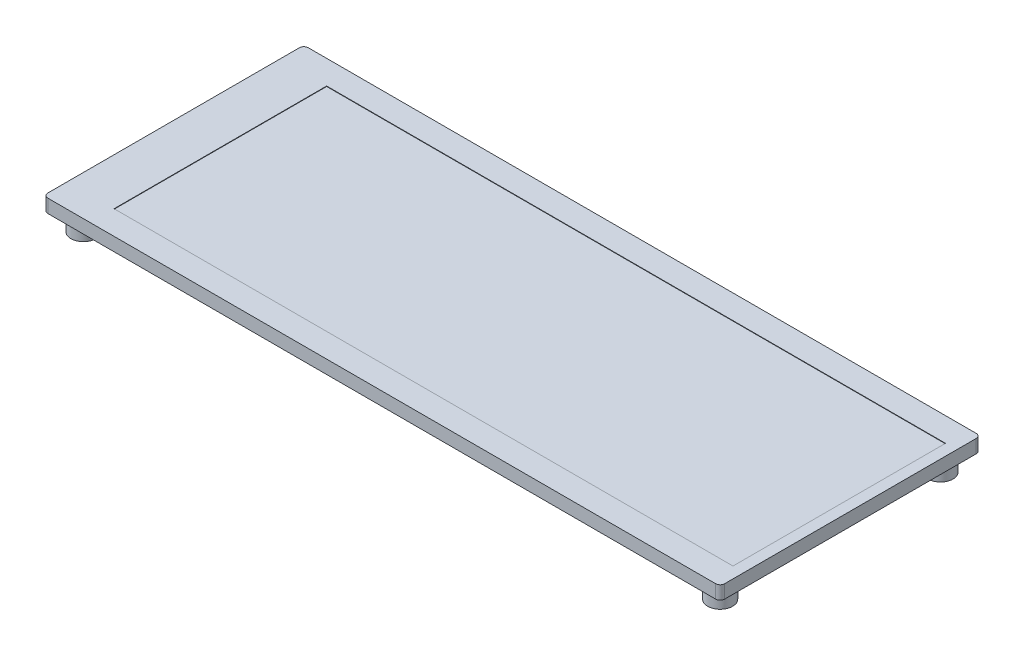
from build123d import *

# Parameters (mm, degrees)
EXTRUDE_1_DEPTH                            = 3
SKETCH_2_W                                 = 139
SKETCH_2_H                                 = 47.74
CUT_EXTRUDE_1_DEPTH                        = 0.1
SKETCH_3_R                                 = 2.8
EXTRUDE_2_DEPTH                            = 4
SKETCH_4_R                                 = 1
CUT_EXTRUDE_2_DEPTH                        = 4
MIRROR_1_AT_THE_SECOND_PLANE_COPY_1_SKET_R = 2.8
MIRROR_1_AT_THE_SECOND_PLANE_COPY_1_DEPTH  = 4
MIRROR_1_AT_THE_SECOND_PLANE_COPY_2_SKET_R = 1
MIRROR_1_AT_THE_SECOND_PLANE_COPY_2_DEPTH  = 4
SKETCH_5_W                                 = 6
SKETCH_5_H                                 = 11
EXTRUDE_3_DEPTH                            = 1.7
SKETCH_6_W                                 = 6
SKETCH_6_H                                 = 17
EXTRUDE_4_DEPTH                            = 4


with BuildPart() as part:
    # ｽｹｯﾁ1 → ﾎﾞｽ - 押し出し1 (new body)
    with BuildSketch(Plane(origin=(0, 0, 0), x_dir=(1, 0, 0), z_dir=(0, 1, 0))):
        with BuildLine():
            Line((-75, 29.25), (75, 29.25))
            ThreePointArc((75, 29.25), (75.707106781, 28.957106781), (76, 28.25))
            Line((76, 28.25), (76, -28.25))
            ThreePointArc((76, -28.25), (75.707106781, -28.957106781), (75, -29.25))
            Line((75, -29.25), (-75, -29.25))
            ThreePointArc((-75, -29.25), (-75.707106781, -28.957106781), (-76, -28.25))
            Line((-76, -28.25), (-76, 28.25))
            ThreePointArc((-76, 28.25), (-75.707106781, 28.957106781), (-75, 29.25))
        make_face()
    extrude(amount=EXTRUDE_1_DEPTH)

    # ｽｹｯﾁ2 → ｶｯﾄ - 押し出し1 (cut)
    with BuildSketch(Plane(origin=(0, 3, 0), x_dir=(1, 0, 0), z_dir=(0, 1, 0))):
        with Locations((4, 0)):
            Rectangle(SKETCH_2_W, SKETCH_2_H)
    extrude(amount=-CUT_EXTRUDE_1_DEPTH, mode=Mode.SUBTRACT)

    # ｽｹｯﾁ3 → ﾎﾞｽ - 押し出し2 (add)
    with BuildSketch(Plane.XZ):
        with Locations(Location((-71.5, 24.75, 0), (0, 0, 270))):
            Circle(SKETCH_3_R)
    extrude_2 = extrude(amount=EXTRUDE_2_DEPTH)

    # ｽｹｯﾁ4 → ｶｯﾄ - 押し出し2 (cut)
    with BuildSketch(Plane.XZ.offset(4)):
        with Locations(Location((-71.5, 24.75, 0), (0, 0, 270))):
            Circle(SKETCH_4_R)
    cut_extrude_2 = extrude(amount=-CUT_EXTRUDE_2_DEPTH, mode=Mode.SUBTRACT)

    # ﾐﾗｰ1: ﾎﾞｽ - 押し出し2, ｶｯﾄ - 押し出し2 across plane
    add(extrude_2.mirror(Plane(origin=(0, 0, 0), x_dir=(0, 0, 1), z_dir=(1, 0, 0))))
    add(cut_extrude_2.mirror(Plane(origin=(0, 0, 0), x_dir=(0, 0, 1), z_dir=(1, 0, 0))), mode=Mode.SUBTRACT)

    # ﾐﾗｰ1 at the second plane: ﾎﾞｽ - 押し出し2, ｶｯﾄ - 押し出し2 across plane
    add(extrude_2.mirror(Plane.XY))
    add(cut_extrude_2.mirror(Plane.XY), mode=Mode.SUBTRACT)

    # ﾐﾗｰ1 at the second plane copy 1 sket → ﾐﾗｰ1 at the second plane copy 1 (add)
    with BuildSketch(Plane(origin=(0, 0, 0), x_dir=(-1, 0, 0), z_dir=(0, -1, 0))):
        with Locations(Location((-71.5, 24.75, 0), (0, 0, 270))):
            Circle(MIRROR_1_AT_THE_SECOND_PLANE_COPY_1_SKET_R)
    extrude(amount=MIRROR_1_AT_THE_SECOND_PLANE_COPY_1_DEPTH)

    # ﾐﾗｰ1 at the second plane copy 2 sket → ﾐﾗｰ1 at the second plane copy 2 (cut)
    with BuildSketch(Plane(origin=(0, -4, 0), x_dir=(-1, 0, 0), z_dir=(0, -1, 0))):
        with Locations(Location((-71.5, 24.75, 0), (0, 0, 270))):
            Circle(MIRROR_1_AT_THE_SECOND_PLANE_COPY_2_SKET_R)
    extrude(amount=-MIRROR_1_AT_THE_SECOND_PLANE_COPY_2_DEPTH, mode=Mode.SUBTRACT)

    # ｽｹｯﾁ5 → ﾎﾞｽ - 押し出し3 (add)
    with BuildSketch(Plane.XZ):
        with Locations((-60, 0)):
            Rectangle(SKETCH_5_W, SKETCH_5_H)
    extrude(amount=EXTRUDE_3_DEPTH)

    # ｽｹｯﾁ6 → ﾎﾞｽ - 押し出し4 (add)
    with BuildSketch(Plane.XZ):
        with Locations((64.5, 0)):
            Rectangle(SKETCH_6_W, SKETCH_6_H)
    extrude(amount=EXTRUDE_4_DEPTH)


solid = part.part
